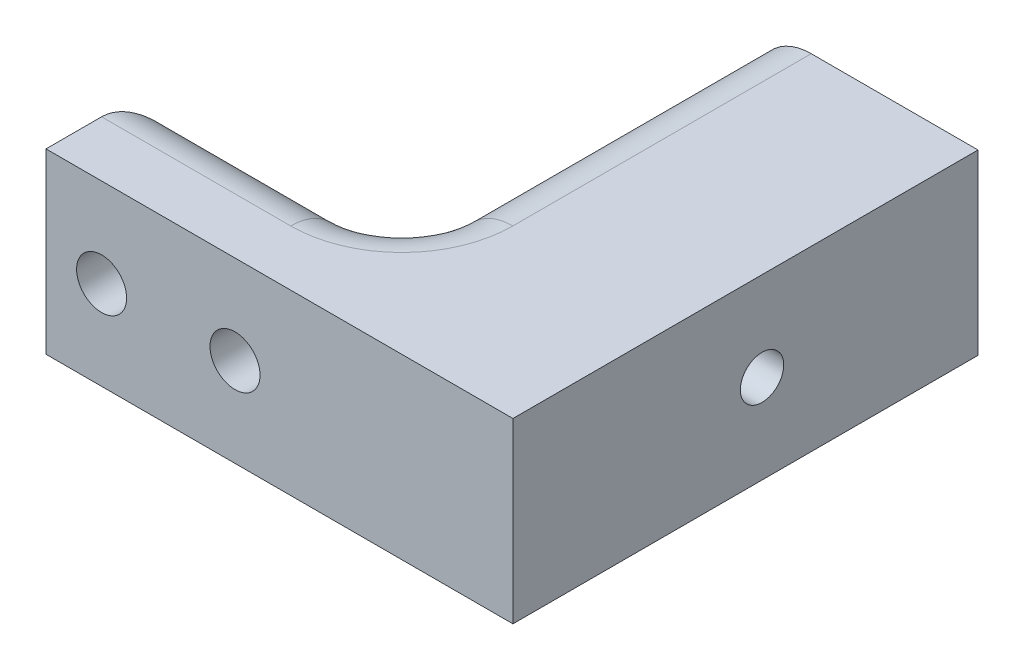
from build123d import *

# Parameters (mm, degrees)
ESQUISSE1_W                     = 42
ESQUISSE1_H                     = 16
BOSS_EXTRU_1_DEPTH              = 41.83
ESQUISSE2_W                     = 22
ESQUISSE2_H                     = 31.83
ENL_V_MAT_EXTRU_1_DEPTH         = 50.464622712
CONG_1_R                        = 5
D_GAGEMENT_M3_51_D              = 3.9
DIAM_TRE_DU_PER_AGE_4_5_4_5_2_D = 4.5
ENL_V_MAT_EXTRU_2_DEPTH         = 17


with BuildPart() as part:
    # Esquisse1 → Boss.-Extru.1 (new body)
    with BuildSketch(Plane.XY):
        Rectangle(ESQUISSE1_W, ESQUISSE1_H)
    extrude(amount=BOSS_EXTRU_1_DEPTH)

    # Esquisse2 → Enlèv. mat.-Extru.1 (cut, through all)
    with BuildSketch(Plane.XZ.offset(8)):
        with Locations((-10, 15.915)):
            Rectangle(ESQUISSE2_W, ESQUISSE2_H)
    extrude(amount=-ENL_V_MAT_EXTRU_1_DEPTH, mode=Mode.SUBTRACT)

    # Congé1
    cong_1_edges = [part.edges().sort_by_distance(p)[0] for p in [
        (-10, 8, 31.83),
        (-21, 0, 31.83),
        (1, 8, 15.915),
        (1, 0, 31.83),
        (1, -8, 15.915),
        (-10, -8, 31.83),
    ]]
    fillet(cong_1_edges, radius=CONG_1_R)

    # Dégagement M3.51 (through all)
    with Locations(Plane(origin=(21, 0, 0), x_dir=(0, 0, -1), z_dir=(1, 0, 0))):
        with Locations((-19.425, 0)):
            Hole(D_GAGEMENT_M3_51_D / 2)

    # Diamètre du perçage Ø4.5 (4.5)2 (through all)
    with Locations(Plane.XY.offset(41.83)):
        with Locations((-16, 0), (-4, 0)):
            Hole(DIAM_TRE_DU_PER_AGE_4_5_4_5_2_D / 2)

    # Esquisse7 → Enlèv. mat.-Extru.2 (cut)
    with BuildSketch(Plane(origin=(1, 0, 0), x_dir=(0, 0, -1), z_dir=(1, 0, 0))):
        Polygon((-24.10153718, 0), (-21.76326859, -4.05), (-17.08673141, -4.05), (-14.74846282, 0), (-17.08673141, 4.05), (-21.76326859, 4.05), align=None)
    extrude(amount=ENL_V_MAT_EXTRU_2_DEPTH, mode=Mode.SUBTRACT)


solid = part.part
